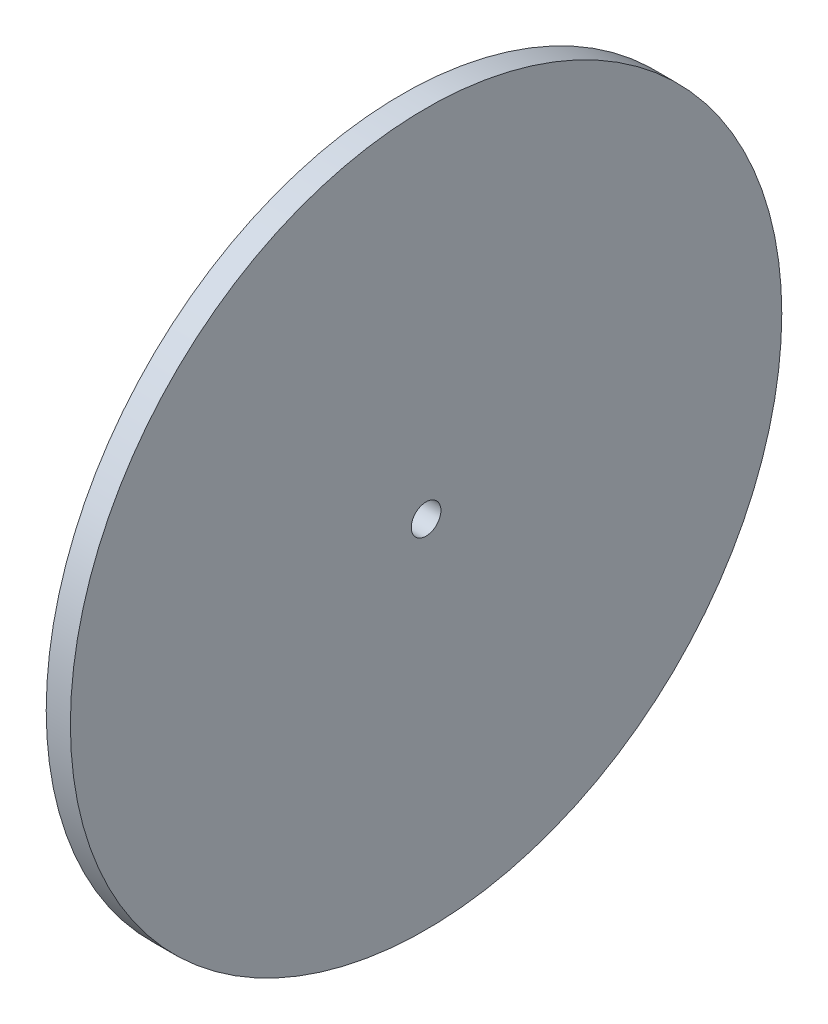
from build123d import *

# Parameters (mm, degrees)
SKETCH3_R          = 1
CUT_EXTRUDE1_DEPTH = 35.152073144


with BuildPart() as part:
    # Sketch2 → Revolve1 (revolve)
    with BuildSketch(Plane.XY, mode=Mode.PRIVATE) as revolve1_sk:
        Polygon((0, 0), (0, 24), (-1.63, 24), (-1.63, 3.5), (-3.79, 3.5), (-3.79, 2.35), (-1.63, 2.35), (-1.63, 0), align=None)
    revolve(revolve1_sk.sketch.rotate(Axis((-1.63, 0, 0), (1, 0, 0)), 90), axis=Axis((-1.63, 0, 0), (1, 0, 0)))

    # Sketch3 → Cut-Extrude1 (cut, through all)
    with BuildSketch(Plane(origin=(0, 0, 0), x_dir=(0, 0, -1), z_dir=(1, 0, 0))):
        Circle(SKETCH3_R)
    extrude(amount=-CUT_EXTRUDE1_DEPTH, mode=Mode.SUBTRACT)


solid = part.part
